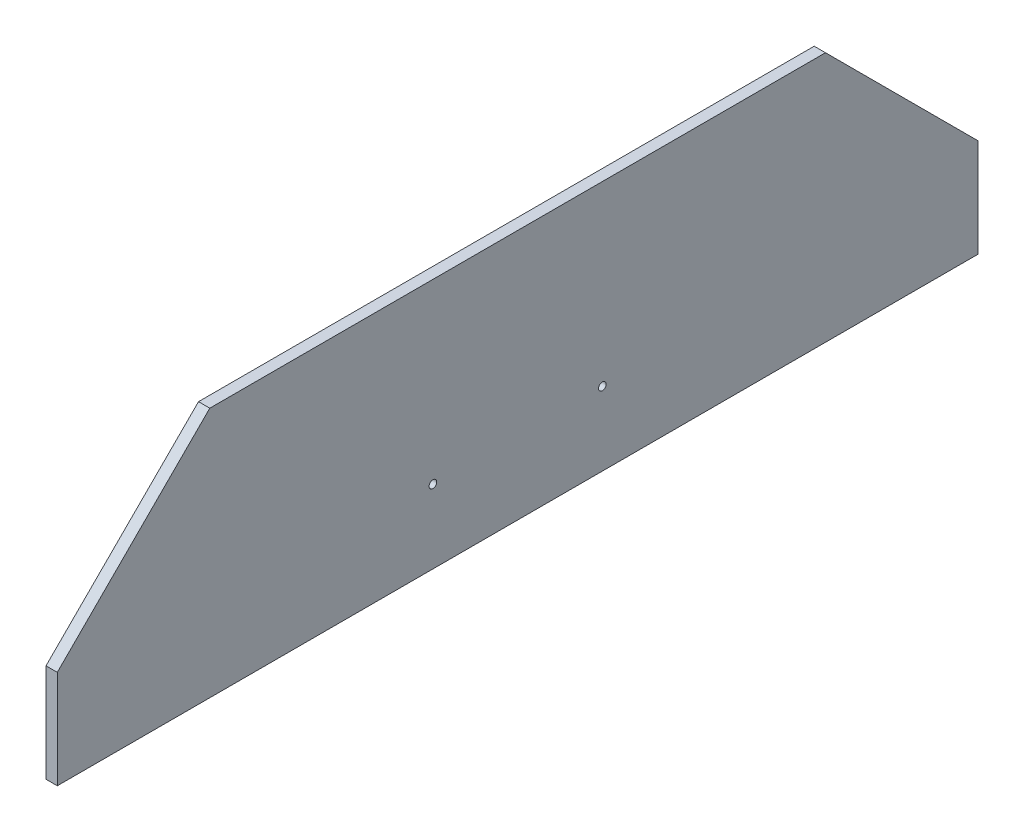
from build123d import *

# Parameters (mm, degrees)
SKETCH1_W               = 815
SKETCH1_H               = 222
BOSS_EXTRUDE1_DEPTH     = 10
CHAMFER1_SIZE           = 135
F_1_4_CLEARANCE_HOLE1_D = 6.7564


with BuildPart() as part:
    # Sketch1 → Boss-Extrude1 (new body)
    with BuildSketch(Plane(origin=(0, 0, 0), x_dir=(0, 0, -1), z_dir=(1, 0, 0))):
        with Locations((407.5, 111)):
            Rectangle(SKETCH1_W, SKETCH1_H)
    extrude(amount=BOSS_EXTRUDE1_DEPTH)

    # Chamfer1
    chamfer1_edges = [part.edges().sort_by_distance(p)[0] for p in [
        (5, 222, 0),
        (5, 222, -815),
    ]]
    chamfer(chamfer1_edges, length=CHAMFER1_SIZE)

    # 1/4 Clearance Hole1 (through all)
    with Locations(Plane(origin=(10, 0, 0), x_dir=(0, 0, -1), z_dir=(1, 0, 0))):
        with Locations((482.5, 65), (332.5, 65)):
            Hole(F_1_4_CLEARANCE_HOLE1_D / 2)


solid = part.part
